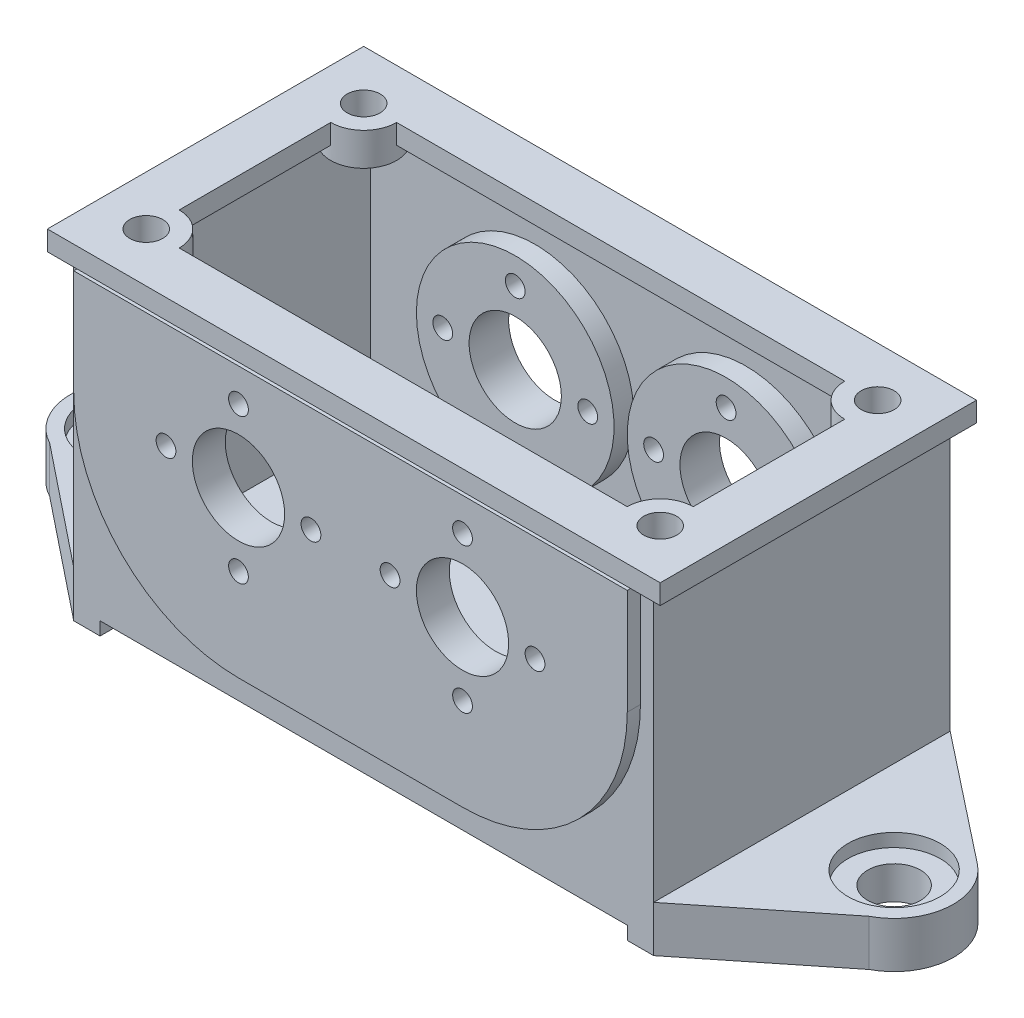
from build123d import *

# Parameters (mm, degrees)
BOSS_EXTRUDE5_DEPTH  = 7
SKETCH10_W           = 88
SKETCH10_H           = 45
SKETCH10_W_2         = 82
SKETCH10_H_2         = 39
BOSS_EXTRUDE6_DEPTH  = 41
SKETCH11_W           = 93
SKETCH11_H           = 48
SKETCH11_W_2         = 78
SKETCH11_H_2         = 33
BOSS_EXTRUDE7_DEPTH  = 3
SKETCH12_R           = 5
BOSS_EXTRUDE8_DEPTH  = 5
SKETCH13_R           = 2.5
CUT_EXTRUDE1_DEPTH   = 5
SKETCH14_R           = 15
BOSS_EXTRUDE9_DEPTH  = 3
SKETCH16_R           = 7
CUT_EXTRUDE2_DEPTH   = 22
SKETCH17_R           = 1.5
CUT_EXTRUDE3_DEPTH   = 22
SKETCH18_W           = 80
SKETCH18_H           = 2
CUT_EXTRUDE4_DEPTH   = 92
BOSS_EXTRUDE11_DEPTH = 2
SKETCH20_R           = 7
CUT_EXTRUDE5_DEPTH   = 14
SKETCH21_R           = 1.5
CUT_EXTRUDE6_DEPTH   = 14
SKETCH22_R           = 4
CUT_EXTRUDE8_DEPTH   = 14
SKETCH23_R           = 7
CUT_EXTRUDE9_DEPTH   = 2


with BuildPart() as part:
    # Sketch9 → Boss-Extrude5 (new body)
    with BuildSketch(Plane(origin=(0, 0, 0), x_dir=(1, 0, 0), z_dir=(0, 1, 0))):
        with BuildLine():
            Line((-44, 22.5), (44, 22.5))
            Line((44, 22.5), (63.572502172, 7.067334685))
            ThreePointArc((63.572502172, 7.067334685), (66.961735718, -0.829031319), (62.181462037, -7.969653395))
            Line((62.181462037, -7.969653395), (44, -22.5))
            Line((44, -22.5), (-44, -22.5))
            Line((-44, -22.5), (-62.181462037, -7.969653395))
            ThreePointArc((-62.181462037, -7.969653395), (-66.961735718, -0.829031319), (-63.572502172, 7.067334685))
            Line((-63.572502172, 7.067334685), (-44, 22.5))
        make_face()
    extrude(amount=BOSS_EXTRUDE5_DEPTH)

    # Sketch10 → Boss-Extrude6 (add)
    with BuildSketch(Plane(origin=(0, 7, 0), x_dir=(1, 0, 0), z_dir=(0, 1, 0))):
        Rectangle(SKETCH10_W, SKETCH10_H)
        Rectangle(SKETCH10_W_2, SKETCH10_H_2, mode=Mode.SUBTRACT)
    extrude(amount=BOSS_EXTRUDE6_DEPTH)

    # Sketch11 → Boss-Extrude7 (add)
    with BuildSketch(Plane(origin=(0, 48, 0), x_dir=(1, 0, 0), z_dir=(0, 1, 0))):
        Rectangle(SKETCH11_W, SKETCH11_H)
        Rectangle(SKETCH11_W_2, SKETCH11_H_2, mode=Mode.SUBTRACT)
    extrude(amount=BOSS_EXTRUDE7_DEPTH)

    # Sketch12 → Boss-Extrude8 (add)
    with BuildSketch(Plane(origin=(0, 51, 0), x_dir=(1, 0, 0), z_dir=(0, 1, 0))):
        with Locations((39, 16.5)):
            Circle(SKETCH12_R)
        with Locations((39, -16.5)):
            Circle(SKETCH12_R)
        with Locations((-39, -16.5)):
            Circle(SKETCH12_R)
        with Locations((-39, 16.5)):
            Circle(SKETCH12_R)
    extrude(amount=-BOSS_EXTRUDE8_DEPTH)

    # Sketch13 → Cut-Extrude1 (cut)
    with BuildSketch(Plane(origin=(0, 51, 0), x_dir=(1, 0, 0), z_dir=(0, 1, 0))):
        with Locations(Location((39, 16.5, 0), (0, 0, 270))):
            Circle(SKETCH13_R)
        with Locations(Location((39, -16.5, 0), (0, 0, 323.130102354))):
            Circle(SKETCH13_R)
        with Locations(Location((-39, 16.5, 0), (0, 0, 216.869897646))):
            Circle(SKETCH13_R)
        with Locations(Location((-39, -16.5, 0), (0, 0, 270))):
            Circle(SKETCH13_R)
    extrude(amount=-CUT_EXTRUDE1_DEPTH, mode=Mode.SUBTRACT)

    # Sketch14 → Boss-Extrude9 (add)
    with BuildSketch(Plane.XY.offset(-19.5)):
        with Locations((16, 27.5)):
            Circle(SKETCH14_R)
        with Locations(Location((-16, 27.5, 0), (0, 0, 180))):
            Circle(SKETCH14_R)
    extrude(amount=BOSS_EXTRUDE9_DEPTH)

    # Sketch16 → Cut-Extrude2 (cut)
    with BuildSketch(Plane.XY.offset(-16.5)):
        with Locations((-16, 27.5)):
            Circle(SKETCH16_R)
        with Locations((16, 27.5)):
            Circle(SKETCH16_R)
    extrude(amount=-CUT_EXTRUDE2_DEPTH, mode=Mode.SUBTRACT)

    # Sketch17 → Cut-Extrude3 (cut)
    with BuildSketch(Plane.XY.offset(-16.5)):
        with Locations((16, 38.5)):
            Circle(SKETCH17_R)
        with Locations((27, 27.5)):
            Circle(SKETCH17_R)
        with Locations((16, 16.5)):
            Circle(SKETCH17_R)
        with Locations((5, 27.5)):
            Circle(SKETCH17_R)
        with Locations((-5, 27.5)):
            Circle(SKETCH17_R)
        with Locations((-16, 16.5)):
            Circle(SKETCH17_R)
        with Locations((-27, 27.5)):
            Circle(SKETCH17_R)
        with Locations((-16, 38.5)):
            Circle(SKETCH17_R)
    extrude(amount=-CUT_EXTRUDE3_DEPTH, mode=Mode.SUBTRACT)

    # Sketch18 → Cut-Extrude4 (cut)
    with BuildSketch(Plane.XY.offset(22.5)):
        with Locations((0, 1)):
            Rectangle(SKETCH18_W, SKETCH18_H)
    extrude(amount=-CUT_EXTRUDE4_DEPTH, mode=Mode.SUBTRACT)

    # Sketch19 → Boss-Extrude11 (add)
    with BuildSketch(Plane.XY.offset(22.5)):
        with BuildLine():
            Line((-42, 48), (42, 48))
            Line((42, 48), (42, 32))
            ThreePointArc((42, 32), (34.67766953, 14.32233047), (17, 7))
            Line((17, 7), (-17, 7))
            ThreePointArc((-17, 7), (-34.67766953, 14.32233047), (-42, 32))
            Line((-42, 32), (-42, 48))
        make_face()
    extrude(amount=BOSS_EXTRUDE11_DEPTH)

    # Sketch20 → Cut-Extrude5 (cut)
    with BuildSketch(Plane.XY.offset(24.5)):
        with Locations((-17, 32)):
            Circle(SKETCH20_R)
        with Locations(Location((17, 32, 0), (0, 0, 180))):
            Circle(SKETCH20_R)
    extrude(amount=-CUT_EXTRUDE5_DEPTH, mode=Mode.SUBTRACT)

    # Sketch21 → Cut-Extrude6 (cut)
    with BuildSketch(Plane.XY.offset(24.5)):
        with Locations((-17, 43)):
            Circle(SKETCH21_R)
        with Locations((-6, 32)):
            Circle(SKETCH21_R)
        with Locations((-17, 21)):
            Circle(SKETCH21_R)
        with Locations((-28, 32)):
            Circle(SKETCH21_R)
        with Locations(Location((17, 21, 0), (0, 0, 180))):
            Circle(SKETCH21_R)
        with Locations(Location((28, 32, 0), (0, 0, 180))):
            Circle(SKETCH21_R)
        with Locations(Location((17, 43, 0), (0, 0, 180))):
            Circle(SKETCH21_R)
        with Locations(Location((6, 32, 0), (0, 0, 180))):
            Circle(SKETCH21_R)
    extrude(amount=-CUT_EXTRUDE6_DEPTH, mode=Mode.SUBTRACT)

    # Sketch22 → Cut-Extrude8 (cut)
    with BuildSketch(Plane(origin=(0, 7, 0), x_dir=(1, 0, 0), z_dir=(0, 1, 0))):
        with Locations(Location((-58, 0, 0), (0, 0, 270))):
            Circle(SKETCH22_R)
        with Locations(Location((58, 0, 0), (0, 0, 90))):
            Circle(SKETCH22_R)
    extrude(amount=-CUT_EXTRUDE8_DEPTH, mode=Mode.SUBTRACT)

    # Sketch23 → Cut-Extrude9 (cut)
    with BuildSketch(Plane(origin=(0, 7, 0), x_dir=(1, 0, 0), z_dir=(0, 1, 0))):
        with Locations(Location((-58, 0, 0), (0, 0, 270))):
            Circle(SKETCH23_R)
        with Locations(Location((58, 0, 0), (0, 0, 90))):
            Circle(SKETCH23_R)
    extrude(amount=-CUT_EXTRUDE9_DEPTH, mode=Mode.SUBTRACT)


solid = part.part
